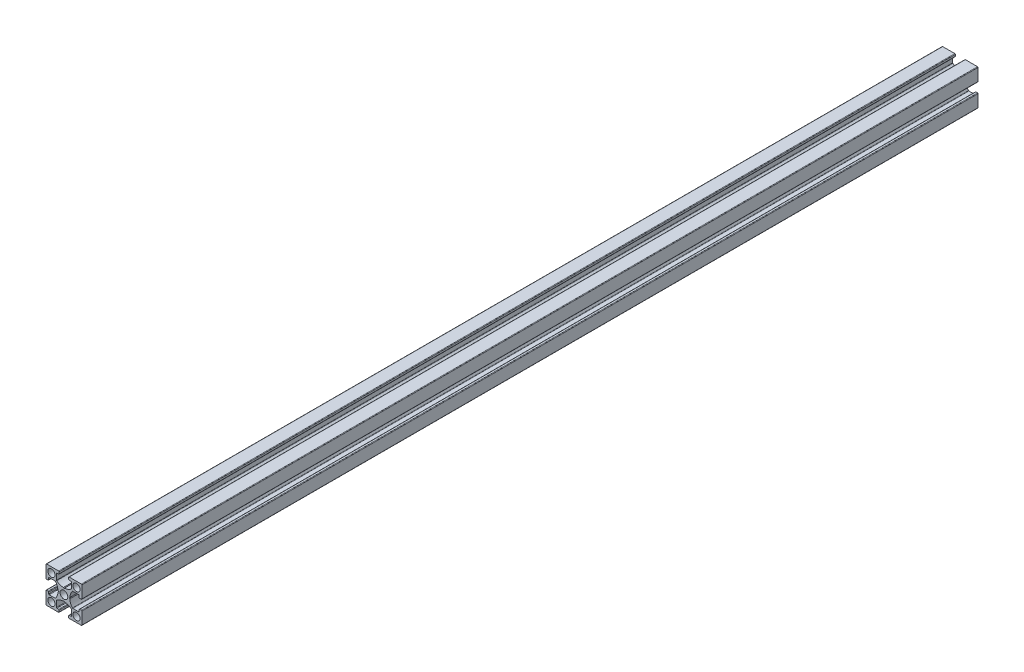
from build123d import *

# Parameters (mm, degrees)
MODEL_R         = 2.15
MODEL_R_2       = 2
EXTRUDE_1_DEPTH = 500


with BuildPart() as part:
    # Model → 보스-돌출1 (new body)
    with BuildSketch(Plane.XY):
        with BuildLine():
            Line((2307.763927197, 1192.134297913), (2307.763927197, 1195.391548465))
            ThreePointArc((2307.763927197, 1195.391548465), (2307.676059232, 1195.603680499), (2307.463927197, 1195.691548465))
            Line((2307.463927197, 1195.691548465), (2306.563927197, 1195.691548465))
            ThreePointArc((2306.563927197, 1195.691548465), (2306.351795163, 1195.779416431), (2306.263927197, 1195.991548465))
            Line((2306.263927197, 1195.991548465), (2306.263927197, 1196.891548465))
            ThreePointArc((2306.263927197, 1196.891548465), (2306.351795163, 1197.103680499), (2306.563927197, 1197.191548465))
            Line((2306.563927197, 1197.191548465), (2313.313927197, 1197.191548465))
            ThreePointArc((2313.313927197, 1197.191548465), (2313.526059232, 1197.103680499), (2313.613927197, 1196.891548465))
            Line((2313.613927197, 1196.891548465), (2313.613927197, 1190.141548465))
            ThreePointArc((2313.613927197, 1190.141548465), (2313.526059232, 1189.929416431), (2313.313927197, 1189.841548465))
            Line((2313.313927197, 1189.841548465), (2312.413927197, 1189.841548465))
            ThreePointArc((2312.413927197, 1189.841548465), (2312.201795163, 1189.929416431), (2312.113927197, 1190.141548465))
            Line((2312.113927197, 1190.141548465), (2312.113927197, 1191.041548465))
            ThreePointArc((2312.113927197, 1191.041548465), (2312.026059232, 1191.253680499), (2311.813927197, 1191.341548465))
            Line((2311.813927197, 1191.341548465), (2308.556676645, 1191.341548465))
            ThreePointArc((2308.556676645, 1191.341548465), (2308.426234796, 1191.311705686), (2308.321744595, 1191.228114625))
            ThreePointArc((2308.321744595, 1191.228114625), (2307.328306374, 1189.47356999), (2306.921204563, 1187.498825831))
            Line((2306.921204563, 1187.498825831), (2306.613927197, 1187.191548465))
            Line((2306.613927197, 1187.191548465), (2306.921204563, 1186.884271099))
            ThreePointArc((2306.921204563, 1186.884271099), (2307.328306374, 1184.90952694), (2308.321744595, 1183.154982305))
            ThreePointArc((2308.321744595, 1183.154982305), (2308.426234796, 1183.071391244), (2308.556676645, 1183.041548465))
            Line((2308.556676645, 1183.041548465), (2311.813927197, 1183.041548465))
            ThreePointArc((2311.813927197, 1183.041548465), (2312.026059232, 1183.129416431), (2312.113927197, 1183.341548465))
            Line((2312.113927197, 1183.341548465), (2312.113927197, 1184.241548465))
            ThreePointArc((2312.113927197, 1184.241548465), (2312.201795163, 1184.453680499), (2312.413927197, 1184.541548465))
            Line((2312.413927197, 1184.541548465), (2313.313927197, 1184.541548465))
            ThreePointArc((2313.313927197, 1184.541548465), (2313.526059232, 1184.453680499), (2313.613927197, 1184.241548465))
            Line((2313.613927197, 1184.241548465), (2313.613927197, 1177.491548465))
            ThreePointArc((2313.613927197, 1177.491548465), (2313.526059232, 1177.279416431), (2313.313927197, 1177.191548465))
            Line((2313.313927197, 1177.191548465), (2306.563927197, 1177.191548465))
            ThreePointArc((2306.563927197, 1177.191548465), (2306.351795163, 1177.279416431), (2306.263927197, 1177.491548465))
            Line((2306.263927197, 1177.491548465), (2306.263927197, 1178.391548465))
            ThreePointArc((2306.263927197, 1178.391548465), (2306.351795163, 1178.603680499), (2306.563927197, 1178.691548465))
            Line((2306.563927197, 1178.691548465), (2307.463927197, 1178.691548465))
            ThreePointArc((2307.463927197, 1178.691548465), (2307.676059232, 1178.779416431), (2307.763927197, 1178.991548465))
            Line((2307.763927197, 1178.991548465), (2307.763927197, 1182.248799017))
            ThreePointArc((2307.763927197, 1182.248799017), (2307.734084418, 1182.379240866), (2307.650493357, 1182.483731067))
            ThreePointArc((2307.650493357, 1182.483731067), (2305.895948722, 1183.477169289), (2303.921204563, 1183.884271099))
            Line((2303.921204563, 1183.884271099), (2303.613927197, 1184.191548465))
            Line((2303.613927197, 1184.191548465), (2303.306649831, 1183.884271099))
            ThreePointArc((2303.306649831, 1183.884271099), (2301.331905673, 1183.477169289), (2299.577361038, 1182.483731067))
            ThreePointArc((2299.577361038, 1182.483731067), (2299.493769977, 1182.379240866), (2299.463927197, 1182.248799017))
            Line((2299.463927197, 1182.248799017), (2299.463927197, 1178.991548465))
            ThreePointArc((2299.463927197, 1178.991548465), (2299.551795163, 1178.779416431), (2299.763927197, 1178.691548465))
            Line((2299.763927197, 1178.691548465), (2300.663927197, 1178.691548465))
            ThreePointArc((2300.663927197, 1178.691548465), (2300.876059232, 1178.603680499), (2300.963927197, 1178.391548465))
            Line((2300.963927197, 1178.391548465), (2300.963927197, 1177.491548465))
            ThreePointArc((2300.963927197, 1177.491548465), (2300.876059232, 1177.279416431), (2300.663927197, 1177.191548465))
            Line((2300.663927197, 1177.191548465), (2293.913927197, 1177.191548465))
            ThreePointArc((2293.913927197, 1177.191548465), (2293.701795163, 1177.279416431), (2293.613927197, 1177.491548465))
            Line((2293.613927197, 1177.491548465), (2293.613927197, 1184.241548465))
            ThreePointArc((2293.613927197, 1184.241548465), (2293.701795163, 1184.453680499), (2293.913927197, 1184.541548465))
            Line((2293.913927197, 1184.541548465), (2294.813927197, 1184.541548465))
            ThreePointArc((2294.813927197, 1184.541548465), (2295.026059232, 1184.453680499), (2295.113927197, 1184.241548465))
            Line((2295.113927197, 1184.241548465), (2295.113927197, 1183.341548465))
            ThreePointArc((2295.113927197, 1183.341548465), (2295.201795163, 1183.129416431), (2295.413927197, 1183.041548465))
            Line((2295.413927197, 1183.041548465), (2298.671177749, 1183.041548465))
            ThreePointArc((2298.671177749, 1183.041548465), (2298.801619599, 1183.071391244), (2298.906109799, 1183.154982305))
            ThreePointArc((2298.906109799, 1183.154982305), (2299.899548021, 1184.90952694), (2300.306649831, 1186.884271099))
            Line((2300.306649831, 1186.884271099), (2300.613927197, 1187.191548465))
            Line((2300.613927197, 1187.191548465), (2300.306649831, 1187.498825831))
            ThreePointArc((2300.306649831, 1187.498825831), (2299.899548021, 1189.47356999), (2298.906109799, 1191.228114625))
            ThreePointArc((2298.906109799, 1191.228114625), (2298.801619599, 1191.311705686), (2298.671177749, 1191.341548465))
            Line((2298.671177749, 1191.341548465), (2295.413927197, 1191.341548465))
            ThreePointArc((2295.413927197, 1191.341548465), (2295.201795163, 1191.253680499), (2295.113927197, 1191.041548465))
            Line((2295.113927197, 1191.041548465), (2295.113927197, 1190.141548465))
            ThreePointArc((2295.113927197, 1190.141548465), (2295.026059232, 1189.929416431), (2294.813927197, 1189.841548465))
            Line((2294.813927197, 1189.841548465), (2293.913927197, 1189.841548465))
            ThreePointArc((2293.913927197, 1189.841548465), (2293.701795163, 1189.929416431), (2293.613927197, 1190.141548465))
            Line((2293.613927197, 1190.141548465), (2293.613927197, 1196.891548465))
            ThreePointArc((2293.613927197, 1196.891548465), (2293.701795163, 1197.103680499), (2293.913927197, 1197.191548465))
            Line((2293.913927197, 1197.191548465), (2300.663927197, 1197.191548465))
            ThreePointArc((2300.663927197, 1197.191548465), (2300.876059232, 1197.103680499), (2300.963927197, 1196.891548465))
            Line((2300.963927197, 1196.891548465), (2300.963927197, 1195.991548465))
            ThreePointArc((2300.963927197, 1195.991548465), (2300.876059232, 1195.779416431), (2300.663927197, 1195.691548465))
            Line((2300.663927197, 1195.691548465), (2299.763927197, 1195.691548465))
            ThreePointArc((2299.763927197, 1195.691548465), (2299.551795163, 1195.603680499), (2299.463927197, 1195.391548465))
            Line((2299.463927197, 1195.391548465), (2299.463927197, 1192.134297913))
            ThreePointArc((2299.463927197, 1192.134297913), (2299.493769977, 1192.003856063), (2299.577361038, 1191.899365863))
            ThreePointArc((2299.577361038, 1191.899365863), (2301.331905673, 1190.905927641), (2303.306649831, 1190.498825831))
            Line((2303.306649831, 1190.498825831), (2303.613927197, 1190.191548465))
            Line((2303.613927197, 1190.191548465), (2303.921204563, 1190.498825831))
            ThreePointArc((2303.921204563, 1190.498825831), (2305.895948722, 1190.905927641), (2307.650493357, 1191.899365863))
            ThreePointArc((2307.650493357, 1191.899365863), (2307.734084418, 1192.003856063), (2307.763927197, 1192.134297913))
        make_face()
        with Locations((2303.613927197, 1187.191548465)):
            Circle(MODEL_R, mode=Mode.SUBTRACT)
        with Locations((2296.613927197, 1194.191548465)):
            Circle(MODEL_R_2, mode=Mode.SUBTRACT)
        with Locations((2296.613927197, 1180.191548465)):
            Circle(MODEL_R_2, mode=Mode.SUBTRACT)
        with Locations((2310.613927197, 1194.191548465)):
            Circle(MODEL_R_2, mode=Mode.SUBTRACT)
        with Locations((2310.613927197, 1180.191548465)):
            Circle(MODEL_R_2, mode=Mode.SUBTRACT)
    extrude(amount=EXTRUDE_1_DEPTH)


solid = part.part
